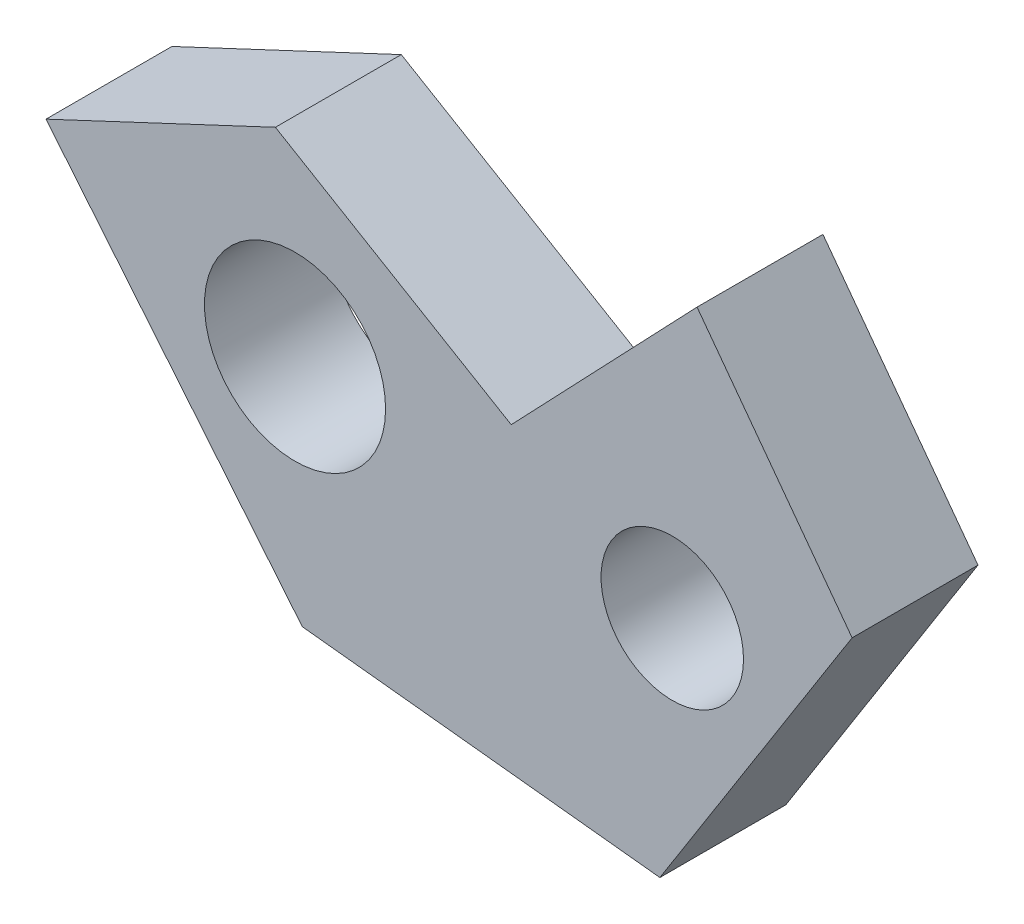
from build123d import *

# Parameters (mm, degrees)
BOSS_EXTRUDE1_DEPTH = 40
SKETCH2_R           = 22.631847918
SKETCH2_R_2         = 28.776537022
CUT_EXTRUDE2_DEPTH  = 40


with BuildPart() as part:
    # Sketch1 → Boss-Extrude1 (new body)
    with BuildSketch(Plane.XY):
        Polygon((-147.819271396, 6.108234355), (-74.927674757, 40.314346744), (0, -4.072156237), (59.046265434, 57.824618563), (108.319355899, -8.551528097), (47.237012347, -105.061630909), (-66.37614666, -92.845162199), align=None)
    extrude(amount=BOSS_EXTRUDE1_DEPTH)

    # Sketch2 → Cut-Extrude2 (cut)
    with BuildSketch(Plane.XY.offset(40)):
        with Locations((51.179511342, -31.732249283)):
            Circle(SKETCH2_R)
        with Locations((-68.695439343, -19.703274992)):
            Circle(SKETCH2_R_2)
    extrude(amount=-CUT_EXTRUDE2_DEPTH, mode=Mode.SUBTRACT)


solid = part.part
